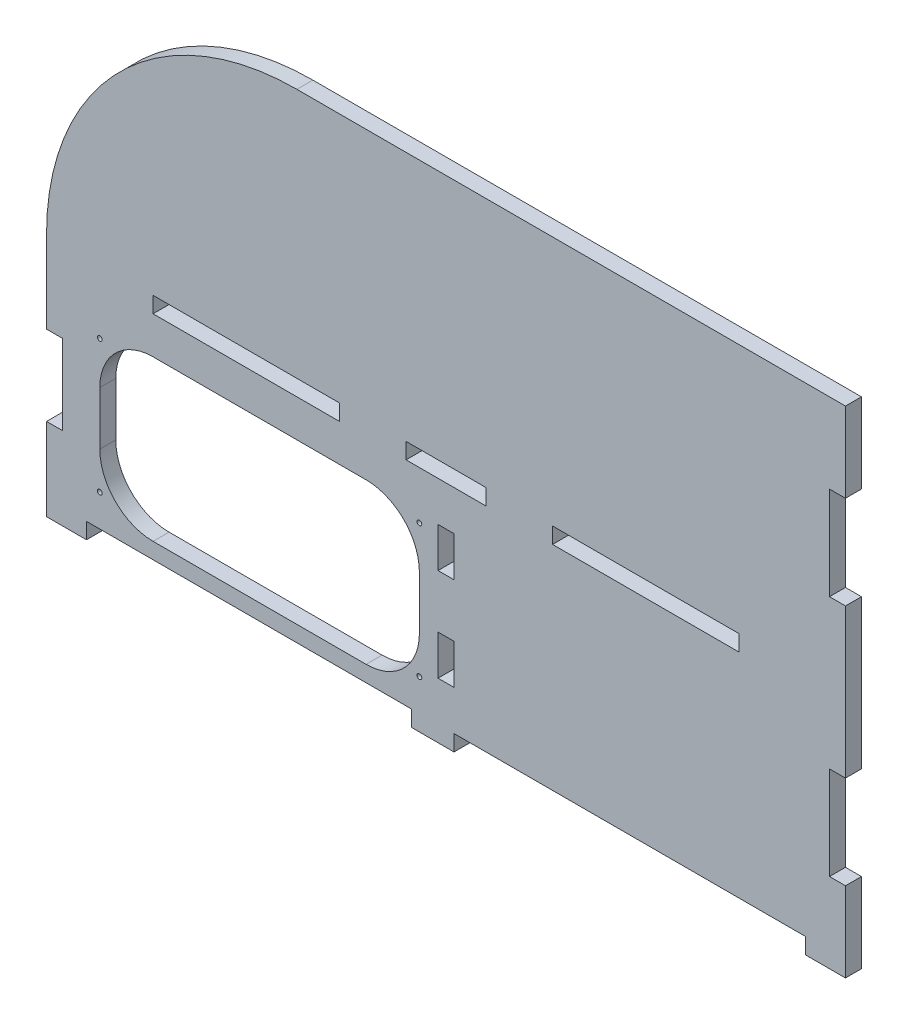
from build123d import *

# Parameters (mm, degrees)
SKETCH1_W           = 300
SKETCH1_H           = 186
BOSS_EXTRUDE1_DEPTH = 6
FILLET1_R           = 94
CUT_EXTRUDE1_DEPTH  = 10
SKETCH3_W           = 70
SKETCH3_H           = 6
SKETCH3_W_2         = 6
SKETCH3_H_2         = 30
SKETCH3_W_3         = 122
SKETCH3_H_3         = 35
SKETCH3_W_4         = 30
SKETCH3_H_4         = 15
SKETCH3_W_5         = 132
CUT_EXTRUDE2_DEPTH  = 6
SKETCH4_R           = 0.9
CUT_EXTRUDE3_DEPTH  = 6


with BuildPart() as part:
    # Sketch1 → Boss-Extrude1 (new body)
    with BuildSketch(Plane.XY):
        Rectangle(SKETCH1_W, SKETCH1_H)
    extrude(amount=BOSS_EXTRUDE1_DEPTH)

    # Fillet1
    fillet1_edges = [part.edges().sort_by_distance(p)[0] for p in [
        (-150, 93, 3),
    ]]
    fillet(fillet1_edges, radius=FILLET1_R)

    # Sketch2 → Cut-Extrude1 (cut)
    with BuildSketch(Plane(origin=(0, 0, 0), x_dir=(-1, 0, 0), z_dir=(0, 0, -1))):
        with BuildLine():
            Line((110, -81), (30, -81))
            ThreePointArc((30, -81), (15.857864376, -75.142135624), (10, -61))
            Line((10, -61), (10, -41))
            ThreePointArc((10, -41), (15.857864376, -26.857864376), (30, -21))
            Line((30, -21), (110, -21))
            ThreePointArc((110, -21), (124.142135624, -26.857864376), (130, -41))
            Line((130, -41), (130, -61))
            ThreePointArc((130, -61), (124.142135624, -75.142135624), (110, -81))
        make_face()
    extrude(amount=-CUT_EXTRUDE1_DEPTH, mode=Mode.SUBTRACT)

    # Sketch3 → Cut-Extrude2 (cut)
    with BuildSketch(Plane.XY.offset(6)):
        with Locations((-75, -4)):
            Rectangle(SKETCH3_W, SKETCH3_H)
        with Locations((-147, -47)):
            Rectangle(SKETCH3_W_2, SKETCH3_H_2)
        with Locations((-74, -90)):
            Rectangle(SKETCH3_W_3, SKETCH3_H)
        with Locations((147, 45.5)):
            Rectangle(SKETCH3_W_2, SKETCH3_H_3)
        with Locations((147, -45.5)):
            Rectangle(SKETCH3_W_2, SKETCH3_H_3)
        with Locations((75, -4)):
            Rectangle(SKETCH3_W, SKETCH3_H)
        with Locations((0, -4)):
            Rectangle(SKETCH3_W_4, SKETCH3_H)
        with Locations((0, -29.5)):
            Rectangle(SKETCH3_W_2, SKETCH3_H_4)
        with Locations((0, -64.5)):
            Rectangle(SKETCH3_W_2, SKETCH3_H_4)
        with Locations((69, -90)):
            Rectangle(SKETCH3_W_5, SKETCH3_H)
    extrude(amount=-CUT_EXTRUDE2_DEPTH, mode=Mode.SUBTRACT)

    # Sketch4 → Cut-Extrude3 (cut)
    with BuildSketch(Plane(origin=(0, 0, 0), x_dir=(-1, 0, 0), z_dir=(0, 0, -1))):
        with Locations((130, -75)):
            Circle(SKETCH4_R)
        with Locations((130, -25)):
            Circle(SKETCH4_R)
        with Locations((10, -75)):
            Circle(SKETCH4_R)
        with Locations((10, -25)):
            Circle(SKETCH4_R)
    extrude(amount=-CUT_EXTRUDE3_DEPTH, mode=Mode.SUBTRACT)


solid = part.part
